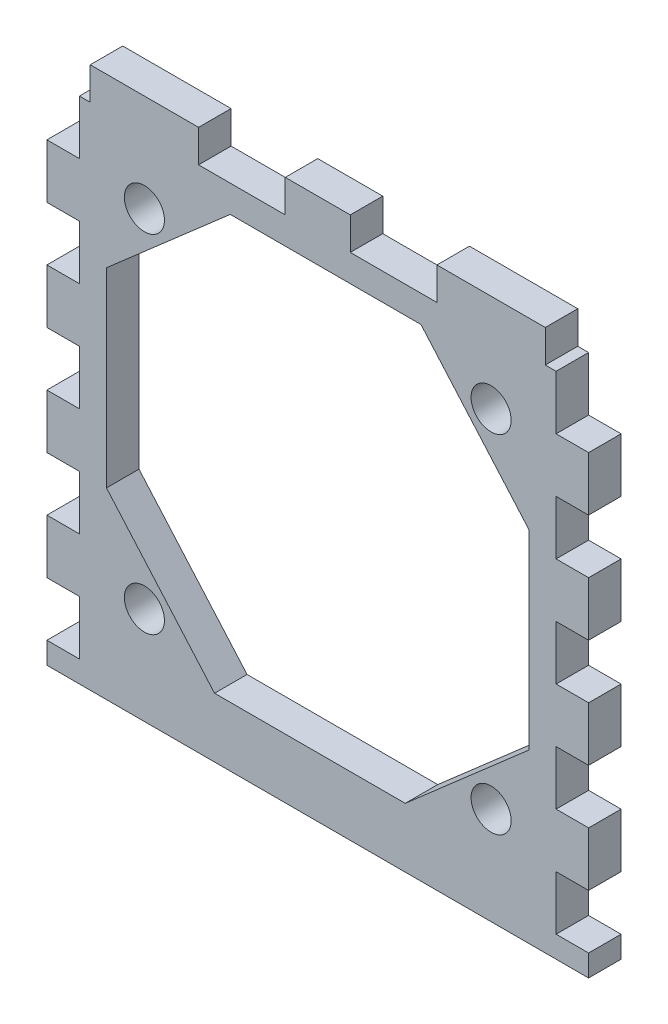
from build123d import *

# Parameters (mm, degrees)
BOSS_EXTRUDE1_DEPTH = 3
SKETCH2_R           = 1.85
CUT_EXTRUDE1_DEPTH  = 71.774289117


with BuildPart() as part:
    # Sketch1 → Boss-Extrude1 (new body)
    with BuildSketch(Plane.XY):
        Polygon((14, 50), (4, 50), (4, 47), (3, 47), (3, 42), (0, 42), (0, 37), (3, 37), (3, 32), (0, 32), (0, 27), (3, 27), (3, 22), (0, 22), (0, 17), (3, 17), (3, 12), (0, 12), (0, 7), (3, 7), (3, 2), (0, 2), (0, 0), (50, 0), (50, 2), (47, 2), (47, 7), (50, 7), (50, 12), (47, 12), (47, 17), (50, 17), (50, 22), (47, 22), (47, 27), (50, 27), (50, 32), (47, 32), (47, 37), (50, 37), (50, 42), (47, 42), (47, 47), (46, 47), (46, 50), (36, 50), (36, 47), (28, 47), (28, 50), (22, 50), (22, 47), (14, 47), align=None)
    extrude(amount=BOSS_EXTRUDE1_DEPTH)

    # Sketch2 → Cut-Extrude1 (cut, through all)
    with BuildSketch(Plane.XY):
        with Locations((9, 41)):
            Circle(SKETCH2_R)
        with Locations((41, 41)):
            Circle(SKETCH2_R)
        with Locations((41, 9)):
            Circle(SKETCH2_R)
        with Locations((9, 9)):
            Circle(SKETCH2_R)
        Polygon((33.074995027, 5.5), (15.474995027, 5.5), (5.5, 16.925004973), (5.5, 34.525004973), (16.925004973, 44.5), (34.525004973, 44.5), (44.5, 33.074995027), (44.5, 15.474995027), align=None)
    extrude(amount=CUT_EXTRUDE1_DEPTH, mode=Mode.SUBTRACT)


solid = part.part
